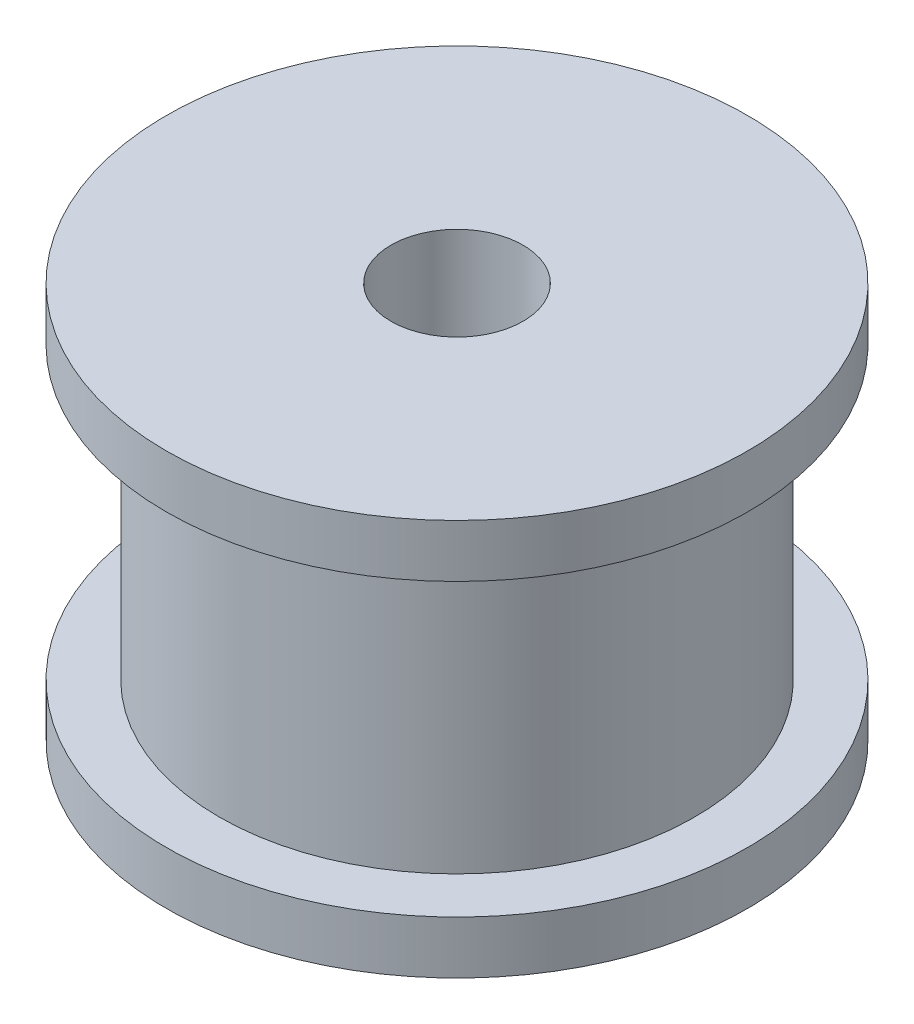
from build123d import *

# Parameters (mm, degrees)
SKETCH_1_R          = 9
EXTRUDE_1_DEPTH     = 11
SKETCH_4_R          = 11
EXTRUDE_3_DEPTH     = 2
EXTRUDE_START       = 2
SKETCH_3_R          = 11
EXTRUDE_4_DEPTH     = 2
SKETCH_5_R          = 2.5
CUT_EXTRUDE_2_DEPTH = 22


with BuildPart() as part:
    # 草图1 → 凸台-拉伸1 (new body)
    with BuildSketch(Plane(origin=(0, 0, 0), x_dir=(1, 0, 0), z_dir=(0, 1, 0))):
        with Locations(Location((0, 0, 0), (0, 0, 270))):
            Circle(SKETCH_1_R)
    extrude(amount=-EXTRUDE_1_DEPTH)

    # 草图4 → 凸台-拉伸3 (add)
    with BuildSketch(Plane(origin=(0, 0, 0), x_dir=(1, 0, 0), z_dir=(0, 1, 0))):
        with Locations(Location((0, 0, 0), (0, 0, 270))):
            Circle(SKETCH_4_R)
    extrude(amount=EXTRUDE_3_DEPTH)

    # 草图3 → 凸台-拉伸4 (add)
    with BuildSketch(Plane.XZ.offset(11).offset(EXTRUDE_START)):
        with Locations(Location((0, 0, 0), (0, 0, 90))):
            Circle(SKETCH_3_R)
    extrude(amount=-EXTRUDE_4_DEPTH)

    # 草图5 → 切除-拉伸2 (cut)
    with BuildSketch(Plane(origin=(0, 2, 0), x_dir=(1, 0, 0), z_dir=(0, 1, 0))):
        with Locations(Location((0, 0, 0), (0, 0, 270))):
            Circle(SKETCH_5_R)
    extrude(amount=-CUT_EXTRUDE_2_DEPTH, mode=Mode.SUBTRACT)


solid = part.part
